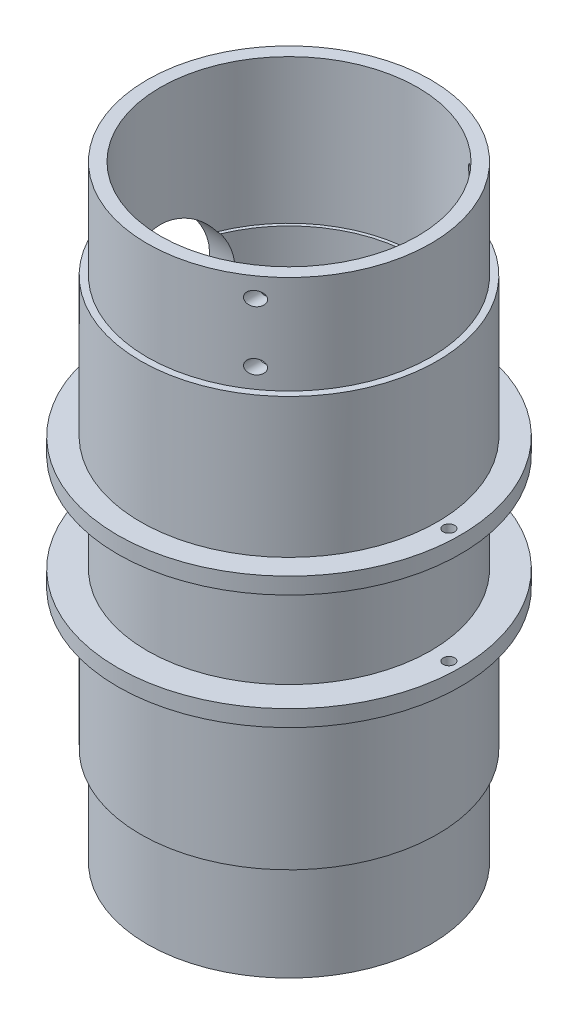
from build123d import *

# Parameters (mm, degrees)
SKETCH1_R                      = 45.25
SKETCH1_R_2                    = 38.25
BOSS_EXTRUDE1_DEPTH            = 92.5
BOSS_EXTRUDE2_START            = -6.35
SKETCH2_R                      = 38.25
SKETCH2_R_2                    = 36.25
BOSS_EXTRUDE2_DEPTH            = 100
CUT_EXTRUDE3_START             = -44
SKETCH6_R                      = 39.25
SKETCH6_R_2                    = 38.25
CUT_EXTRUDE3_DEPTH             = 44
SKETCH7_R                      = 17.5
CUT_EXTRUDE4_DEPTH             = 113.478331247
SKETCH8_R                      = 45.25
SKETCH8_R_2                    = 43.25
CUT_EXTRUDE5_DEPTH             = 30
SKETCH9_R                      = 45.25
SKETCH9_R_2                    = 43.25
CUT_EXTRUDE6_DEPTH             = 15
SKETCH10_R                     = 52.25
SKETCH10_R_2                   = 43.25
SKETCH10_R_3                   = 1.75
BOSS_EXTRUDE3_DEPTH            = 5
CBORE_FOR_M4_SHCS1_D           = 4.3
CBORE_FOR_M4_SHCS1_DEPTH       = 100.101198794
CBORE_FOR_M4_SHCS1_CBORE_D     = 8
CBORE_FOR_M4_SHCS1_CBORE_DEPTH = 4
CBORE_FOR_M4_SHCS1_TIP         = 1.291850331


with BuildPart() as part:
    # Sketch1 → Boss-Extrude1 (new, symmetric)
    with BuildSketch(Plane(origin=(0, 0, 0), x_dir=(1, 0, 0), z_dir=(0, 1, 0))):
        with Locations(Location((0, 0, 0), (0, 0, 270))):
            Circle(SKETCH1_R)
        with Locations(Location((0, 0, 0), (0, 0, 270))):
            Circle(SKETCH1_R_2, mode=Mode.SUBTRACT)
    extrude(amount=BOSS_EXTRUDE1_DEPTH, both=True)

    # Sketch2 → Boss-Extrude2 (add)
    with BuildSketch(Plane.XZ.offset(92.5).offset(BOSS_EXTRUDE2_START)):
        with Locations(Location((0, 0, 0), (0, 0, 270))):
            Circle(SKETCH2_R)
        with Locations(Location((0, 0, 0), (0, 0, 270))):
            Circle(SKETCH2_R_2, mode=Mode.SUBTRACT)
    extrude(amount=-BOSS_EXTRUDE2_DEPTH)

    # Sketch6 → Cut-Extrude3 (cut)
    with BuildSketch(Plane(origin=(0, 92.5, 0), x_dir=(1, 0, 0), z_dir=(0, 1, 0)).offset(CUT_EXTRUDE3_START)):
        with Locations(Location((0, 0, 0), (0, 0, 270))):
            Circle(SKETCH6_R)
        with Locations(Location((0, 0, 0), (0, 0, 90))):
            Circle(SKETCH6_R_2, mode=Mode.SUBTRACT)
    extrude(amount=CUT_EXTRUDE3_DEPTH, mode=Mode.SUBTRACT)

    # Sketch7 → Cut-Extrude4 (cut, through all)
    with BuildSketch(Plane(origin=(0, 0, 0), x_dir=(0, 0, -1), z_dir=(1, 0, 0))):
        with Locations(Location((0, 38.75, 0), (0, 0, 33.858436659))):
            Circle(SKETCH7_R)
    extrude(amount=-CUT_EXTRUDE4_DEPTH, mode=Mode.SUBTRACT)

    # Sketch8 → Cut-Extrude5 (cut)
    with BuildSketch(Plane(origin=(0, 92.5, 0), x_dir=(1, 0, 0), z_dir=(0, 1, 0))):
        with Locations(Location((0, 0, 0), (0, 0, 270))):
            Circle(SKETCH8_R)
        with Locations(Location((0, 0, 0), (0, 0, 270))):
            Circle(SKETCH8_R_2, mode=Mode.SUBTRACT)
    cut_extrude5 = extrude(amount=-CUT_EXTRUDE5_DEPTH, mode=Mode.SUBTRACT)

    # Mirror1: Cut-Extrude5 across plane
    add(cut_extrude5.mirror(Plane.ZX), mode=Mode.SUBTRACT)

    # Sketch9 → Cut-Extrude6 (cut, symmetric)
    with BuildSketch(Plane(origin=(0, 0, 0), x_dir=(1, 0, 0), z_dir=(0, 1, 0))):
        with Locations(Location((0, 0, 0), (0, 0, 270))):
            Circle(SKETCH9_R)
        with Locations(Location((0, 0, 0), (0, 0, 270))):
            Circle(SKETCH9_R_2, mode=Mode.SUBTRACT)
    extrude(amount=CUT_EXTRUDE6_DEPTH, both=True, mode=Mode.SUBTRACT)

    # Sketch10 → Boss-Extrude3 (add)
    with BuildSketch(Plane(origin=(0, 15, 0), x_dir=(-1, 0, 0), z_dir=(0, -1, 0))):
        with Locations(Location((0, 0, 0), (0, 0, 90))):
            Circle(SKETCH10_R)
        with Locations(Location((0, 0, 0), (0, 0, 270))):
            Circle(SKETCH10_R_2, mode=Mode.SUBTRACT)
        with Locations(Location((-48.75, 0, 0), (0, 0, 90))):
            Circle(SKETCH10_R_3, mode=Mode.SUBTRACT)
    boss_extrude3 = extrude(amount=-BOSS_EXTRUDE3_DEPTH)

    # Mirror2: Boss-Extrude3 across plane
    add(boss_extrude3.mirror(Plane.ZX))

    # CBORE for M4 SHCS1
    with Locations(Plane(origin=(401.677021233, -407.224238547, 50.050599397), x_dir=(0.16757219303491572, 0.985859807539322, 0), z_dir=(0, 0, 1))):
        with Locations((405.876811742, 451.068889591), (423.622288278, 454.085189065)):
            CounterBoreHole(CBORE_FOR_M4_SHCS1_D / 2, CBORE_FOR_M4_SHCS1_CBORE_D / 2, CBORE_FOR_M4_SHCS1_CBORE_DEPTH, depth=CBORE_FOR_M4_SHCS1_DEPTH)
            with Locations((0, 0, -(CBORE_FOR_M4_SHCS1_DEPTH + CBORE_FOR_M4_SHCS1_TIP / 2))):  # 118° drill point
                Cone(0, CBORE_FOR_M4_SHCS1_D / 2, CBORE_FOR_M4_SHCS1_TIP, mode=Mode.SUBTRACT)


solid = part.part
